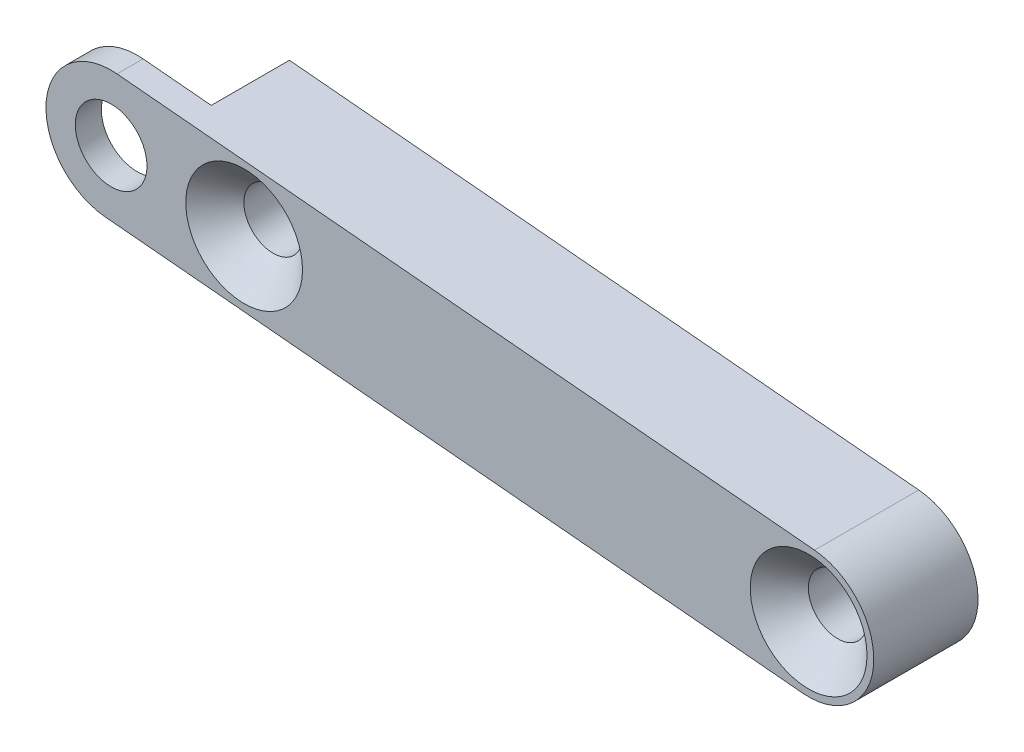
from build123d import *

# Parameters (mm, degrees)
BOSS_EXTRUDE1_DEPTH                                  = 8
CSK_FOR_M4_HEX_SOCKET_COUNTERSUNK_CAP_SC_D           = 4.5
CSK_FOR_M4_HEX_SOCKET_COUNTERSUNK_CAP_SC_CSINK_D     = 8.96
CSK_FOR_M4_HEX_SOCKET_COUNTERSUNK_CAP_SC_CSINK_ANGLE = 90
BOSS_EXTRUDE2_START                                  = -8
BOSS_EXTRUDE2_DEPTH                                  = 8
CUT_EXTRUDE1_DEPTH                                   = 6
M5_CLEARANCE_HOLE1_D                                 = 5.5


with BuildPart() as part:
    # Sketch1 → Boss-Extrude1 (new body)
    with BuildSketch(Plane.XY):
        with BuildLine():
            Line((92.897105977, 25.214321252), (49.577271028, 29.169305441))
            ThreePointArc((49.577271028, 29.169305441), (45.052575538, 34.603192698), (50.486462795, 39.127888188))
            Line((50.486462795, 39.127888188), (93.806297745, 35.172903999))
            ThreePointArc((93.806297745, 35.172903999), (98.330993235, 29.739016742), (92.897105977, 25.214321252))
        make_face()
    extrude(amount=BOSS_EXTRUDE1_DEPTH)

    # CSK for M4 Hex Socket Countersunk Cap Screw1 (through all)
    with Locations(Plane.XY.offset(8)):
        with Locations((93.351701861, 30.193612626), (50.031866911, 34.148596814)):
            CounterSinkHole(CSK_FOR_M4_HEX_SOCKET_COUNTERSUNK_CAP_SC_D / 2, CSK_FOR_M4_HEX_SOCKET_COUNTERSUNK_CAP_SC_CSINK_D / 2, counter_sink_angle=CSK_FOR_M4_HEX_SOCKET_COUNTERSUNK_CAP_SC_CSINK_ANGLE)

    # Sketch6 → Boss-Extrude2 (add)
    with BuildSketch(Plane.XY.offset(8).offset(BOSS_EXTRUDE2_START)):
        with BuildLine():
            Line((39.369723712, 30.101227002), (49.577271028, 29.169305441))
            ThreePointArc((49.577271028, 29.169305441), (45.052575538, 34.603192698), (50.486462795, 39.127888188))
            Line((50.486462795, 39.127888188), (40.278915479, 40.059809749))
            ThreePointArc((40.278915479, 40.059809749), (34.845028222, 35.535114259), (39.369723712, 30.101227002))
        make_face()
    extrude(amount=BOSS_EXTRUDE2_DEPTH)

    # Sketch8 → Cut-Extrude1 (cut)
    with BuildSketch(Plane(origin=(0, 0, 0), x_dir=(-1, 0, 0), z_dir=(0, 0, -1))):
        with BuildLine():
            Line((-39.346993918, 29.852262433), (-44.57524986, 29.374936756))
            Line((-44.57524986, 29.374936756), (-45.529901216, 39.83144864))
            Line((-45.529901216, 39.83144864), (-40.301645274, 40.308774318))
            ThreePointArc((-40.301645274, 40.308774318), (-34.596063653, 35.557844054), (-39.346993918, 29.852262433))
        make_face()
    extrude(amount=-CUT_EXTRUDE1_DEPTH, mode=Mode.SUBTRACT)

    # M5 Clearance Hole1 (through all)
    with Locations(Plane(origin=(0, 0, 6), x_dir=(-1, 0, 0), z_dir=(0, 0, -1))):
        with Locations((-39.824319596, 35.080518376)):
            Hole(M5_CLEARANCE_HOLE1_D / 2)


solid = part.part
